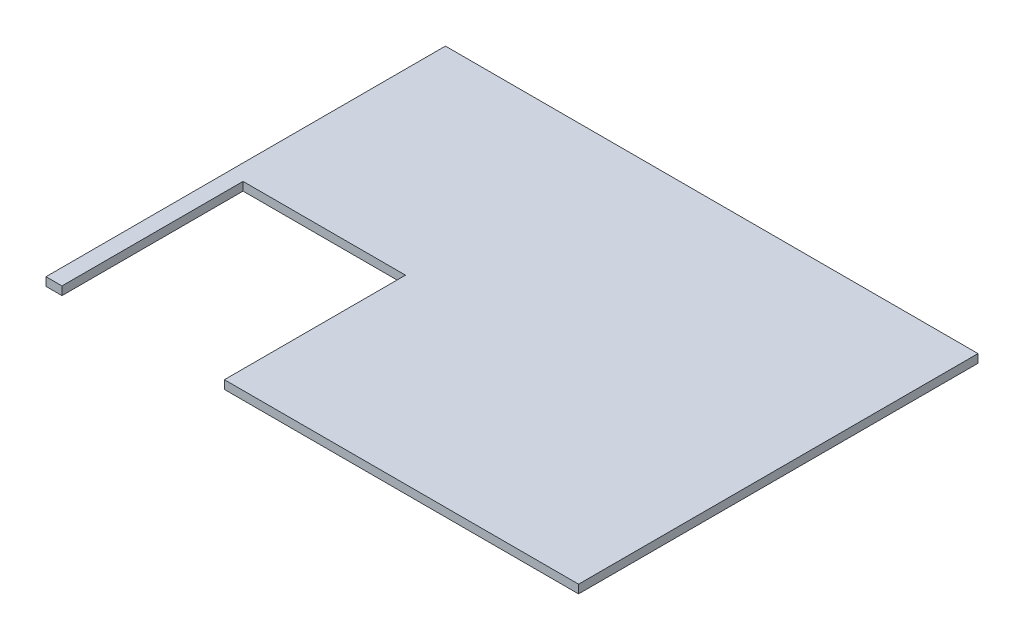
from build123d import *

# Parameters (mm, degrees)
BOSS_EXTRUDE1_DEPTH = 1.5875


with BuildPart() as part:
    # Sketch1 → Boss-Extrude1 (new body)
    with BuildSketch(Plane(origin=(0, 0, 0), x_dir=(1, 0, 0), z_dir=(0, 1, 0))):
        Polygon((0, 0), (3, 0), (3, 34), (33.5, 34), (33.5, 0), (100, 0), (100, 75), (0, 75), align=None)
    extrude(amount=BOSS_EXTRUDE1_DEPTH)


solid = part.part
